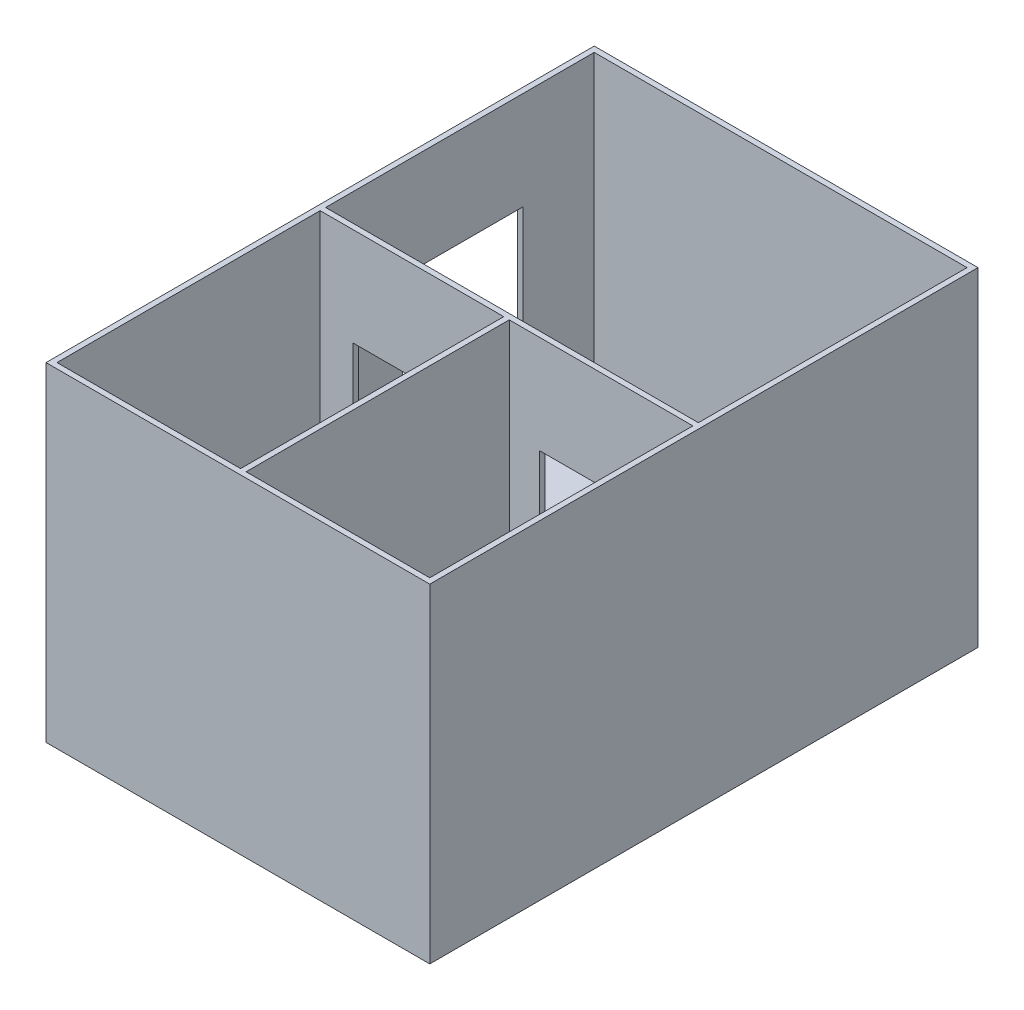
from build123d import *

# Parameters (mm, degrees)
SKETCH2_W           = 3500
SKETCH2_H           = 5000
BOSS_EXTRUDE1_DEPTH = 3000
SHELL1_T            = -50
SKETCH3_W           = 1100
SKETCH3_H           = 2105
CUT_EXTRUDE1_DEPTH  = 50
SKETCH4_W           = 50
SKETCH4_H           = 3000
BOSS_EXTRUDE2_DEPTH = 3500
SKETCH6_W           = 50
SKETCH6_H           = 3000
BOSS_EXTRUDE3_DEPTH = 2500
SKETCH7_W           = 1100
SKETCH7_H           = 2055
SKETCH7_H_2         = 45
SKETCH7_H_3         = 2100
CUT_EXTRUDE5_DEPTH  = 50


with BuildPart() as part:
    # Sketch2 → Boss-Extrude1 (new body)
    with BuildSketch(Plane(origin=(0, 0, 0), x_dir=(1, 0, 0), z_dir=(0, 1, 0))):
        Rectangle(SKETCH2_W, SKETCH2_H)
    extrude(amount=BOSS_EXTRUDE1_DEPTH)

    # Shell1
    shell1_openings = [part.faces().sort_by_distance(p)[0] for p in [
        (0, 3000, 0),
    ]]
    offset(amount=SHELL1_T, openings=shell1_openings, kind=Kind.INTERSECTION)

    # Sketch3 → Cut-Extrude1 (cut)
    with BuildSketch(Plane.ZY.offset(1750)):
        with Locations((-1250, 1052.5)):
            Rectangle(SKETCH3_W, SKETCH3_H)
    extrude(amount=-CUT_EXTRUDE1_DEPTH, mode=Mode.SUBTRACT)

    # Sketch4 → Boss-Extrude2 (add)
    with BuildSketch(Plane.ZY.offset(1750)):
        with Locations((25, 1500)):
            Rectangle(SKETCH4_W, SKETCH4_H)
    extrude(amount=-BOSS_EXTRUDE2_DEPTH)

    # Sketch6 → Boss-Extrude3 (add)
    with BuildSketch(Plane.XY.offset(2500)):
        with Locations((0, 1500)):
            Rectangle(SKETCH6_W, SKETCH6_H)
    extrude(amount=-BOSS_EXTRUDE3_DEPTH)

    # Sketch7 → Cut-Extrude5 (cut)
    with BuildSketch(Plane(origin=(0, 0, 0), x_dir=(-1, 0, 0), z_dir=(0, 0, -1))):
        with Locations((850, 1077.5)):
            Rectangle(SKETCH7_W, SKETCH7_H)
        with Locations((850, 27.5)):
            Rectangle(SKETCH7_W, SKETCH7_H_2)
        with Locations((-850, 1055)):
            Rectangle(SKETCH7_W, SKETCH7_H_3)
    extrude(amount=-CUT_EXTRUDE5_DEPTH, mode=Mode.SUBTRACT)


solid = part.part
